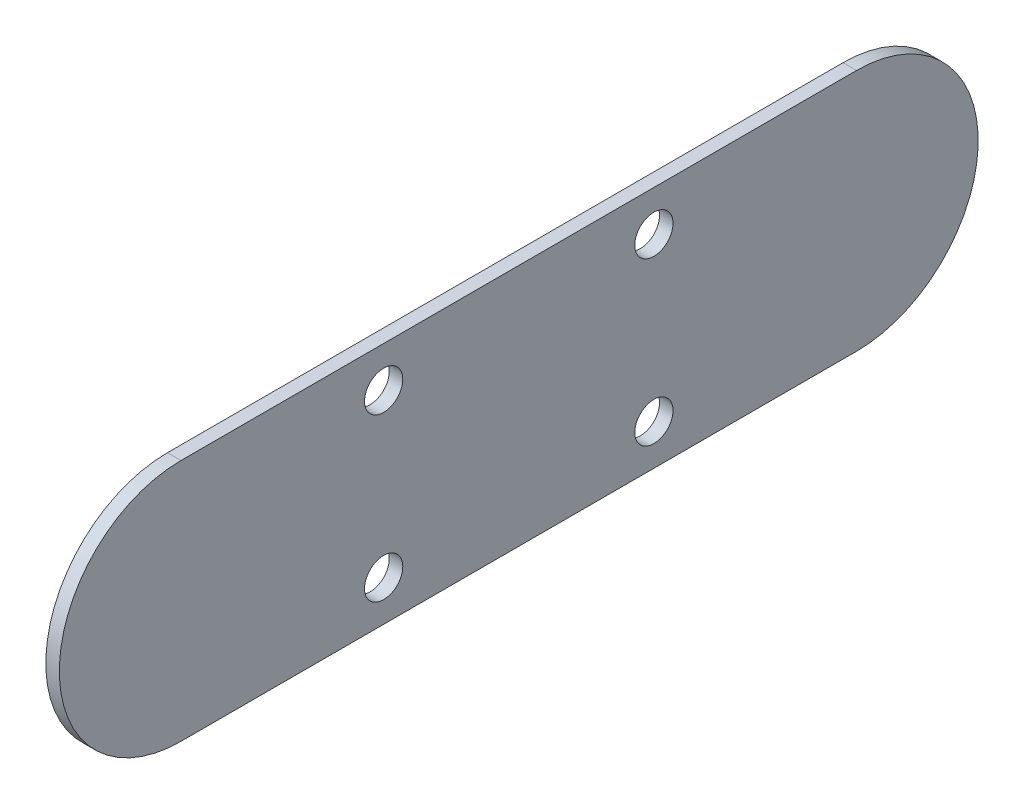
from build123d import *

# Parameters (mm, degrees)
BOSS_EXTRUDE1_DEPTH   = 1.5875
F_8_CLEARANCE_HOLE1_D = 4.4958


with BuildPart() as part:
    # Sketch2 → Boss-Extrude1 (new body)
    with BuildSketch(Plane(origin=(0, 0, 0), x_dir=(0, 0, -1), z_dir=(1, 0, 0))):
        with BuildLine():
            Line((39.6875, -14.2875), (-39.6875, -14.2875))
            ThreePointArc((-39.6875, -14.2875), (-53.975, 0), (-39.6875, 14.2875))
            Line((-39.6875, 14.2875), (39.6875, 14.2875))
            ThreePointArc((39.6875, 14.2875), (53.975, 0), (39.6875, -14.2875))
        make_face()
    extrude(amount=BOSS_EXTRUDE1_DEPTH)

    # #8 Clearance Hole1 (through all)
    with Locations(Plane(origin=(1.5875, 0, 0), x_dir=(0, 0, -1), z_dir=(1, 0, 0))):
        with Locations((-15.875, 9.525), (-15.875, -9.525), (15.875, -9.525), (15.875, 9.525)):
            Hole(F_8_CLEARANCE_HOLE1_D / 2)


solid = part.part
